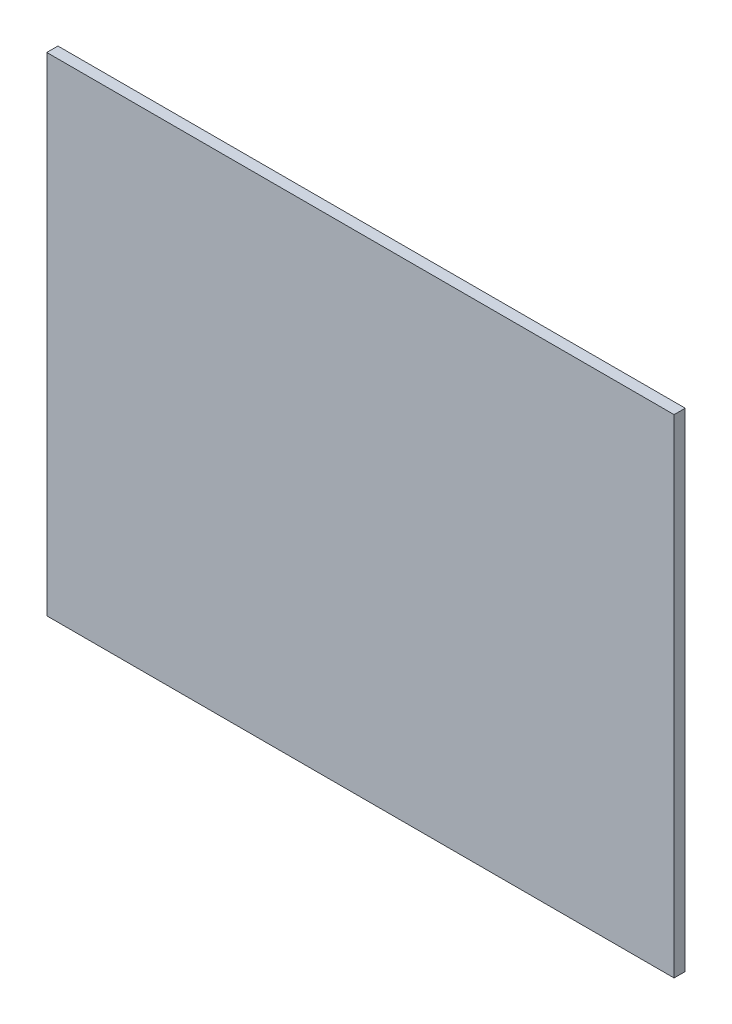
from build123d import *

# Parameters (mm, degrees)
BOSS_EXTRUDE1_DEPTH = 3.2


with BuildPart() as part:
    # Sketch1 → Boss-Extrude1 (new body)
    with BuildSketch(Plane.XY):
        Polygon((22.500001148, -135.00000127), (22.500001148, -125.000000308), (22.500001148, -5.000000308), (22.500001148, 5.000000654), (12.500000186, 5.000000654), (-147.499999814, 5.000000654), (-157.49999917, 5.000000654), (-157.49999917, -5.000000308), (-157.49999917, -125.000000308), (-157.49999917, -135.00000127), (12.500000186, -135.00000127), align=None)
    extrude(amount=BOSS_EXTRUDE1_DEPTH)


solid = part.part
